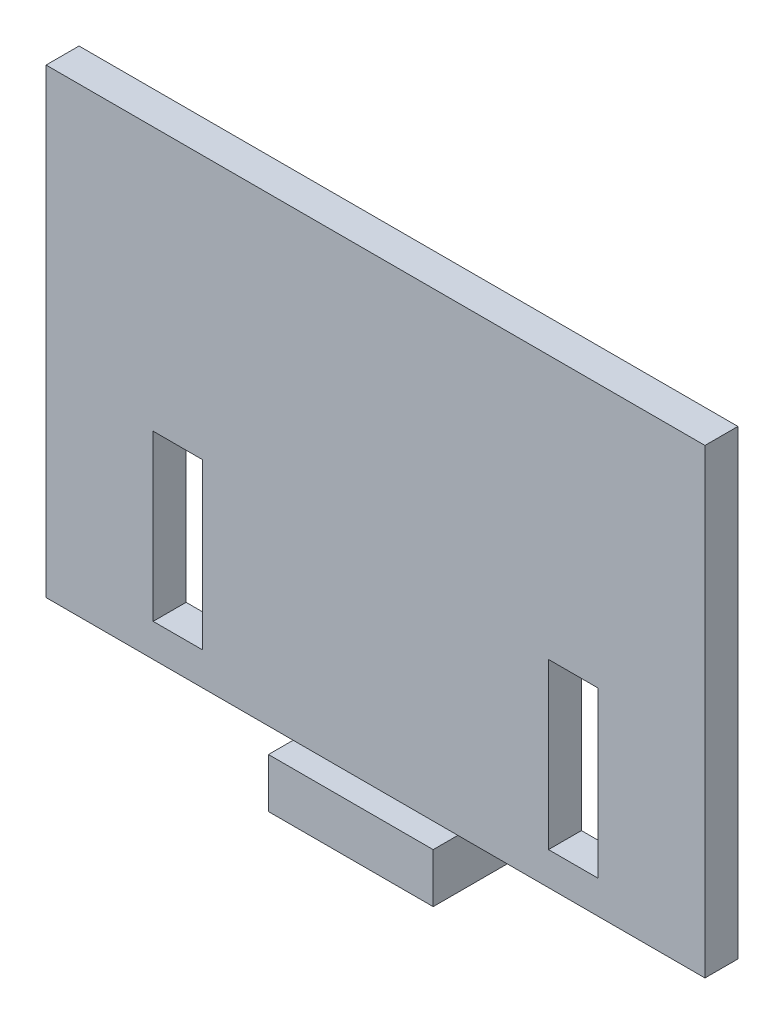
from build123d import *

# Parameters (mm, degrees)
SKETCH1_W               = 40
SKETCH1_H               = 28
BOSS_EXTRUDE1_DEPTH     = 2
CUT_EXTRUDE1_DEPTH      = 25.494897428
CUT_EXTRUDE1_DEPTH_BACK = 25.494897428
SKETCH2_W               = 3
SKETCH2_H               = 10
SKETCH5_W               = 10
SKETCH5_H               = 5
BOSS_EXTRUDE2_DEPTH     = 3


with BuildPart() as part:
    # Sketch1 → Boss-Extrude1 (new body)
    with BuildSketch(Plane.XY):
        Rectangle(SKETCH1_W, SKETCH1_H)
    extrude(amount=BOSS_EXTRUDE1_DEPTH)

    # Sketch2 → Cut-Extrude1 (cut, two sides: drawn at the far end of the back side and taken through both)
    with BuildSketch(Plane.XY.offset(2).offset(-CUT_EXTRUDE1_DEPTH_BACK)):
        with Locations((-12, -7)):
            Rectangle(SKETCH2_W, SKETCH2_H)
        with Locations((12, -7)):
            Rectangle(SKETCH2_W, SKETCH2_H)
    extrude(amount=CUT_EXTRUDE1_DEPTH + CUT_EXTRUDE1_DEPTH_BACK, mode=Mode.SUBTRACT)

    # Sketch5 → Boss-Extrude2 (add)
    with BuildSketch(Plane(origin=(0, -14, 0), x_dir=(-1, 0, 0), z_dir=(0, -1, 0))):
        with Locations((0, -1)):
            Rectangle(SKETCH5_W, SKETCH5_H)
    extrude(amount=BOSS_EXTRUDE2_DEPTH)


solid = part.part
